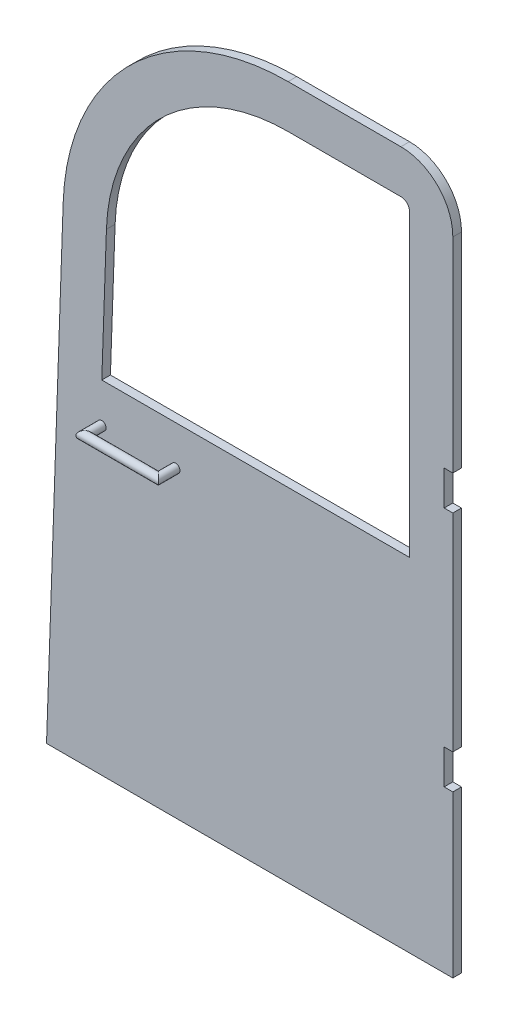
from build123d import *

# Parameters (mm, degrees)
BOSS_EXTRUDE1_DEPTH = 25.4
CUT_EXTRUDE1_DEPTH  = 2217.171715999
SWEEP2_PROFILE_R    = 12.7


with BuildPart() as part:
    # Sketch1 → Boss-Extrude1 (new body)
    with BuildSketch(Plane.XY):
        with BuildLine():
            Line((-318.401962341, 0), (873.874037659, 0))
            Line((873.874037659, 0), (873.874037659, 1883.156))
            ThreePointArc((873.874037659, 1883.156), (829.553846601, 1991.493828188), (721.476635331, 2036.44581097))
            Line((721.476635331, 2036.44581097), (390.514635331, 2036.44581097))
            ThreePointArc((390.514635331, 2036.44581097), (-68.281974684, 1851.0799482), (-269.546688357, 1399.032))
            Line((-269.546688357, 1399.032), (-318.401962341, 0))
        make_face()
        with BuildLine():
            Line((-156.242870874, 1004.607855187), (-142.624053326, 1394.599763919))
            ThreePointArc((-142.624053326, 1394.599763919), (19.939638364, 1759.723793557), (390.514635331, 1909.44581097))
            Line((390.514635331, 1909.44581097), (721.476635331, 1909.44581097))
            ThreePointArc((721.476635331, 1909.44581097), (739.565122057, 1901.8774303), (746.874037659, 1883.682554903))
            Line((746.874037659, 1883.682554903), (746.874037659, 1005.341277451))
            Line((746.874037659, 1005.341277451), (-156.242870874, 1004.607855187))
        make_face(mode=Mode.SUBTRACT)
    extrude(amount=BOSS_EXTRUDE1_DEPTH)

    # Sketch2 → Cut-Extrude1 (cut, through all)
    with BuildSketch(Plane.XY.offset(25.4)):
        Polygon((873.874037659, 1232.505665346), (873.874037659, 1283.305665346), (848.474037659, 1283.305665346), (848.474037659, 1181.705665346), (873.874037659, 1181.705665346), align=None)
        Polygon((873.874037659, 523.771597211), (873.874037659, 574.571597211), (848.474037659, 574.571597211), (848.474037659, 472.971597211), (873.874037659, 472.971597211), align=None)
    extrude(amount=-CUT_EXTRUDE1_DEPTH, mode=Mode.SUBTRACT)

    # Sweep2: sweep along a path in Sketch5
    with BuildLine(Plane(origin=(0, 889, 0), x_dir=(1, 0, 0), z_dir=(0, 1, 0))) as sweep2_path:
        Line((-156.242870874, -25.4), (-156.242870874, -76.2))
        Line((-156.242870874, -76.2), (60.483973487, -76.2))
        Line((60.483973487, -76.2), (60.483973487, -25.4))
        Line((60.483973487, -25.4), (60.483973487, 0))
        Line((60.483973487, 0), (60.483973487, 50.8))
        Line((60.483973487, 50.8), (-156.242870874, 50.8))
        Line((-156.242870874, 50.8), (-156.242870874, 0))
    # Sweep2 profile (on start of the path) → Sweep2 (sweep)
    with BuildSketch(Plane(origin=(-156.242870874, 889, 25.4), x_dir=(1, 0, 0), z_dir=(0, 0, 1))):
        Circle(SWEEP2_PROFILE_R)
    sweep(path=sweep2_path.line, transition=Transition.RIGHT)


solid = part.part
